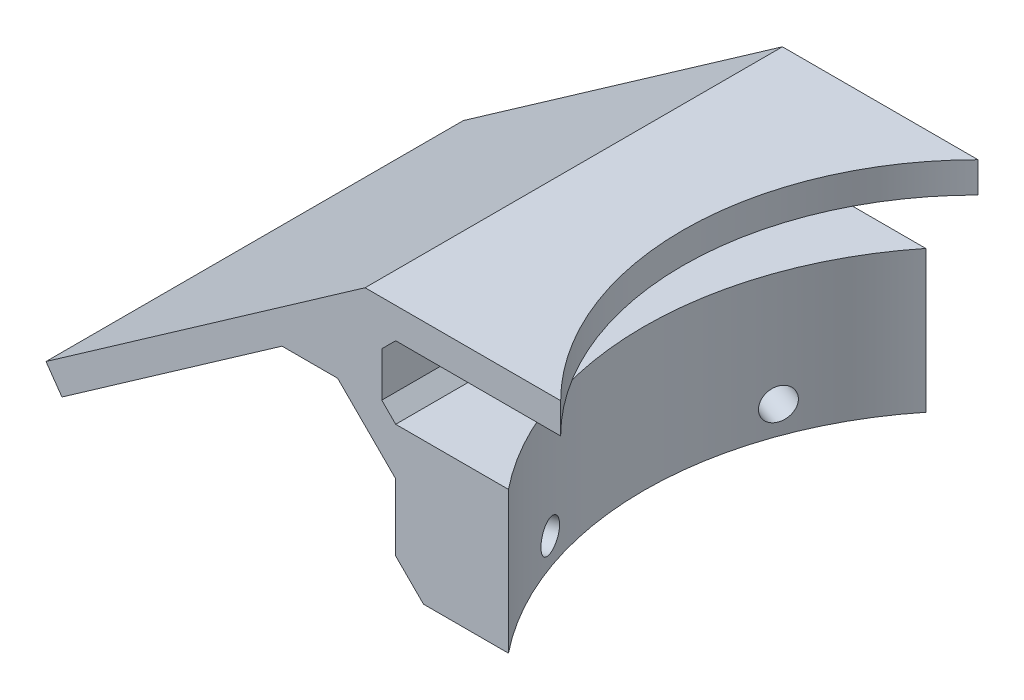
from build123d import *

# Parameters (mm, degrees)
ESTRUSIONE_ESTRUSIONE1_DEPTH       = 75
SCHIZZO2_R                         = 53
TAGLIO_ESTRUSIONE1_DEPTH           = 75
SCHIZZO3_R                         = 60
TAGLIO_ESTRUSIONE2_DEPTH           = 28
FORO_PER_VITE_M3_1_D               = 5.6
FORO_PER_VITE_M3_1_DEPTH           = 8.1
FORO_PER_VITE_M3_1_TIP             = 1.682409733
FORO_PER_VITE_M3_1_ON_FACE_2_D     = 5.6
FORO_PER_VITE_M3_1_ON_FACE_2_DEPTH = 8.1
FORO_PER_VITE_M3_1_ON_FACE_2_TIP   = 1.682409733


with BuildPart() as part:
    # Schizzo1 → Estrusione-Estrusione1 (new body)
    with BuildSketch(Plane.XY):
        Polygon((-6, 38.5), (38.5, 38.5), (38.5, 44), (-11.5, 44), (-68.8406431, 3.849649455), (-65.972760918, -0.246110766), (-26.428417773, 27.443136398), (-16.428417773, 27.443136398), (-6, 17.014718626), (-6, 5), (-1, 0), (0, 0), (20.5, 0), (20.5, 25.5), (0, 25.5), (-6, 25.5), (-8.5, 28), (-8.5, 36), align=None)
    extrude(amount=ESTRUSIONE_ESTRUSIONE1_DEPTH)

    # Schizzo2 → Taglio-Estrusione1 (cut)
    with BuildSketch(Plane(origin=(0, 44, 0), x_dir=(1, 0, 0), z_dir=(0, 1, 0))):
        with Locations((61.1, -37.5)):
            Circle(SCHIZZO2_R)
    extrude(amount=-TAGLIO_ESTRUSIONE1_DEPTH, mode=Mode.SUBTRACT)

    # Schizzo3 → Taglio-Estrusione2 (cut)
    with BuildSketch(Plane.XZ):
        with Locations((61.1, 37.5)):
            Circle(SCHIZZO3_R)
    extrude(amount=-TAGLIO_ESTRUSIONE2_DEPTH, mode=Mode.SUBTRACT)

    # Foro per Vite M3-1
    with Locations(Plane(origin=(4.718442753, 5, 16.9787914), x_dir=(-0.342020143326, 0, 0.939692620786), z_dir=(0.939692620786, 0, 0.342020143326))):
        with Locations((0, 0)):
            Hole(FORO_PER_VITE_M3_1_D / 2, depth=FORO_PER_VITE_M3_1_DEPTH)
            with Locations((0, 0, -(FORO_PER_VITE_M3_1_DEPTH + FORO_PER_VITE_M3_1_TIP / 2))):  # 118° drill point
                Cone(0, FORO_PER_VITE_M3_1_D / 2, FORO_PER_VITE_M3_1_TIP, mode=Mode.SUBTRACT)

    # Foro per Vite M3-1 on face 2
    with Locations(Plane(origin=(4.718442753, 5, 58.0212086), x_dir=(0.342019894889, 0, 0.939692711209), z_dir=(0.939692711209, 0, -0.342019894889))):
        with Locations((0, 0)):
            Hole(FORO_PER_VITE_M3_1_ON_FACE_2_D / 2, depth=FORO_PER_VITE_M3_1_ON_FACE_2_DEPTH)
            with Locations((0, 0, -(FORO_PER_VITE_M3_1_ON_FACE_2_DEPTH + FORO_PER_VITE_M3_1_ON_FACE_2_TIP / 2))):  # 118° drill point
                Cone(0, FORO_PER_VITE_M3_1_ON_FACE_2_D / 2, FORO_PER_VITE_M3_1_ON_FACE_2_TIP, mode=Mode.SUBTRACT)


solid = part.part
